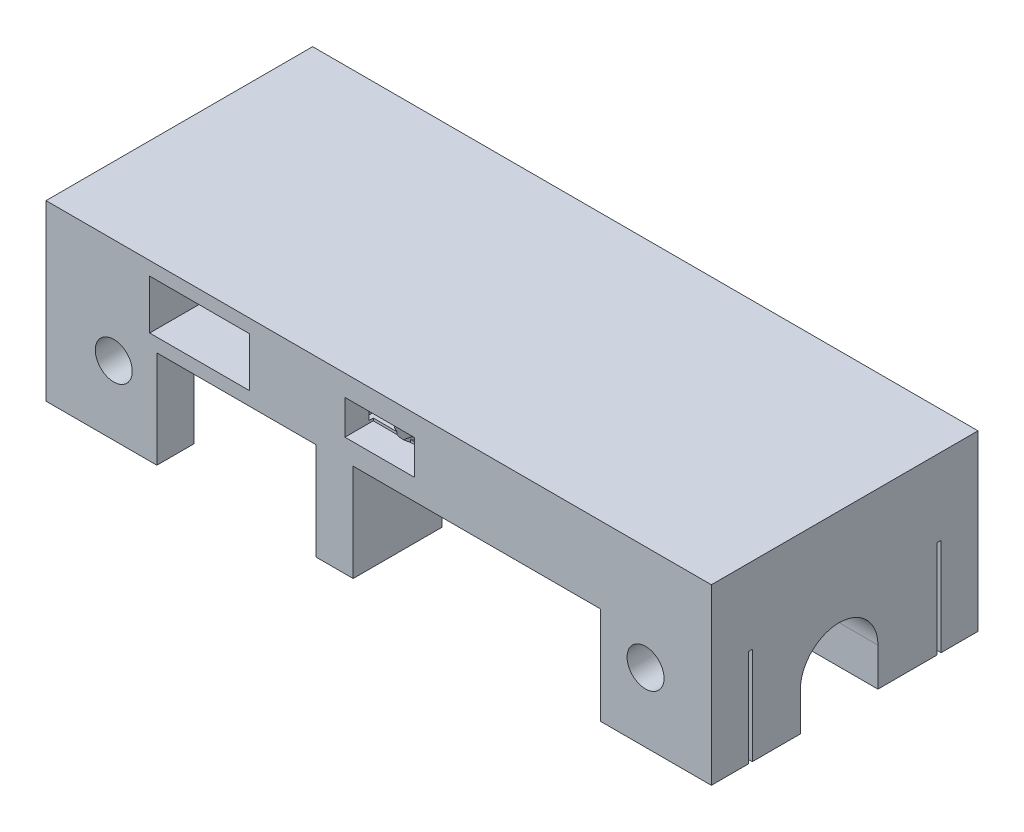
from build123d import *

# Parameters (mm, degrees)
SKETCH2_W           = 54
SKETCH2_H           = 6.2
BOSS_EXTRUDE2_DEPTH = 12.5
SKETCH3_R           = 2.8
CUT_EXTRUDE1_DEPTH  = 6.2
CUT_EXTRUDE2_DEPTH  = 1.9
SKETCH6_W           = 8.1
SKETCH6_H           = 4
CUT_EXTRUDE3_DEPTH  = 8.65741
SKETCH7_W           = 3
SKETCH7_H           = 25
BOSS_EXTRUDE3_DEPTH = 7.9
CUT_EXTRUDE4_DEPTH  = 2
SKETCH9_R           = 0.7
CUT_EXTRUDE5_DEPTH  = 2
SKETCH13_W          = 54
SKETCH13_H          = 2.82
CUT_EXTRUDE6_DEPTH  = 33.925066439
SKETCH18_W          = 3
SKETCH18_H          = 2.82
CUT_EXTRUDE9_DEPTH  = 10
SKETCH19_W          = 0.539072716
SKETCH19_H          = 14.1
CUT_EXTRUDE11_DEPTH = 57.508848865
CUT_EXTRUDE13_DEPTH = 2.5
CUT_EXTRUDE15_START = -2
SKETCH23_R          = 1.6
CUT_EXTRUDE15_DEPTH = 7
CUT_EXTRUDE16_DEPTH = 1.2
SKETCH26_W          = 5.64
SKETCH26_H          = 2.8
CUT_EXTRUDE17_DEPTH = 2.3
SKETCH29_W          = 9
SKETCH29_H          = 3
BOSS_EXTRUDE5_DEPTH = 7.9
SKETCH34_W          = 9
SKETCH34_H          = 7.9
BOSS_EXTRUDE6_DEPTH = 7.5
CUT_EXTRUDE19_DEPTH = 9
CUT_EXTRUDE20_DEPTH = 2.5
SKETCH31_R          = 1.5
CUT_EXTRUDE18_DEPTH = 37.30881069


with BuildPart() as part:
    # Sketch2 → Boss-Extrude2 (new, symmetric)
    with BuildSketch(Plane(origin=(10.528308017, 2.71655886, 0), x_dir=(1, 0, 0), z_dir=(0, 0, 1))):
        with Locations((-10.528308017, -2.71655886)):
            Rectangle(SKETCH2_W, SKETCH2_H)
    extrude(amount=BOSS_EXTRUDE2_DEPTH, both=True)

    # Sketch3 → Cut-Extrude1 (cut)
    with BuildSketch(Plane.XZ.offset(3.1)):
        with Locations((-12.165967216, -142.374755929)):
            Circle(SKETCH3_R)
    extrude(amount=-CUT_EXTRUDE1_DEPTH, mode=Mode.SUBTRACT)

    # Sketch4 → Cut-Extrude2 (cut, symmetric)
    with BuildSketch(Plane(origin=(0, 0, 0), x_dir=(1, 0, 0), z_dir=(0, 1, 0))):
        Polygon((-10.635076842, 0.660738766), (-14.535076842, 2.912404816), (-18.435076842, 0.660738766), (-18.435076842, -3.842593333), (-14.535076842, -6.094259383), (-10.635076842, -3.842593333), align=None)
    extrude(amount=CUT_EXTRUDE2_DEPTH, both=True, mode=Mode.SUBTRACT)

    # Sketch6 → Cut-Extrude3 (cut)
    with BuildSketch(Plane.XY.offset(12.5)):
        with Locations((-14.535076842, 0)):
            Rectangle(SKETCH6_W, SKETCH6_H)
    extrude(amount=-CUT_EXTRUDE3_DEPTH, mode=Mode.SUBTRACT)

    # Sketch7 → Boss-Extrude3 (add)
    with BuildSketch(Plane.XZ.offset(3.1)):
        with Locations((-25.5, 0)):
            Rectangle(SKETCH7_W, SKETCH7_H)
    boss_extrude3 = extrude(amount=BOSS_EXTRUDE3_DEPTH)

    # Sketch8 → Cut-Extrude4 (cut)
    with BuildSketch(Plane.ZY.offset(27)):
        with BuildLine():
            Line((-1.559072716, -7.9), (-1.559072716, -11))
            Line((-1.559072716, -11), (4.740927284, -11))
            Line((4.740927284, -11), (4.740927284, -7.9))
            ThreePointArc((4.740927284, -7.9), (1.590927284, -4.75), (-1.559072716, -7.9))
        make_face()
    cut_extrude4 = extrude(amount=-CUT_EXTRUDE4_DEPTH, mode=Mode.SUBTRACT)

    # Sketch9 → Cut-Extrude5 (cut)
    with BuildSketch(Plane(origin=(-24, 0, 0), x_dir=(0, 0, -1), z_dir=(1, 0, 0))):
        with Locations((142.374755929, -8.1)):
            Circle(SKETCH9_R)
    cut_extrude5 = extrude(amount=-CUT_EXTRUDE5_DEPTH, mode=Mode.SUBTRACT)

    # Sketch13 → Cut-Extrude6 (cut, through all)
    with BuildSketch(Plane(origin=(0, 3.1, 0), x_dir=(1, 0, 0), z_dir=(0, 1, 0))):
        with Locations((0, 11.09)):
            Rectangle(SKETCH13_W, SKETCH13_H)
    extrude(amount=-CUT_EXTRUDE6_DEPTH, mode=Mode.SUBTRACT)

    # Mirror1: Boss-Extrude3, Cut-Extrude4, Cut-Extrude5 across plane
    add(boss_extrude3.mirror(Plane.ZY.offset(14.535076842)))
    add(cut_extrude4.mirror(Plane.ZY.offset(14.535076842)), mode=Mode.SUBTRACT)
    add(cut_extrude5.mirror(Plane.ZY.offset(14.535076842)), mode=Mode.SUBTRACT)

    # Sketch18 → Cut-Extrude9 (cut)
    with BuildSketch(Plane(origin=(0, -3.1, 0), x_dir=(1, 0, 0), z_dir=(0, 1, 0))):
        with Locations((-3.570153685, 11.09)):
            Rectangle(SKETCH18_W, SKETCH18_H)
    extrude(amount=-CUT_EXTRUDE9_DEPTH, mode=Mode.SUBTRACT)

    # Sketch19 → Cut-Extrude11 (cut, through all)
    with BuildSketch(Plane.ZY.offset(27)):
        with Locations((12.230463642, -3.95)):
            Rectangle(SKETCH19_W, SKETCH19_H)
    extrude(amount=-CUT_EXTRUDE11_DEPTH, mode=Mode.SUBTRACT)

    # Sketch22 → Cut-Extrude13 (cut)
    with BuildSketch(Plane.XZ.offset(3.1)):
        Polygon((15, 10.472778345), (12.15, 8.827330078), (12.15, 5.536433544), (15, 3.890985277), (17.85, 5.536433544), (17.85, 8.827330078), align=None)
        Polygon((15, -2.584684642), (12.15, -4.230132909), (12.15, -7.521029443), (15, -9.16647771), (17.85, -7.521029443), (17.85, -4.230132909), align=None)
    extrude(amount=-CUT_EXTRUDE13_DEPTH, mode=Mode.SUBTRACT)

    # Sketch23 → Cut-Extrude15 (cut)
    with BuildSketch(Plane(origin=(0, 3.1, 0), x_dir=(1, 0, 0), z_dir=(0, 1, 0)).offset(CUT_EXTRUDE15_START)):
        with Locations((-0.270153685, 292.910439142)):
            Circle(SKETCH23_R)
        with Locations(Location((-0.270153685, -8.160927284, 0), (0, 0, 180))):
            Circle(SKETCH23_R)
    extrude(amount=-CUT_EXTRUDE15_DEPTH, mode=Mode.SUBTRACT)

    # Sketch24 → Cut-Extrude16 (cut, symmetric)
    with BuildSketch(Plane(origin=(0, 0, 0), x_dir=(1, 0, 0), z_dir=(0, 1, 0))):
        Polygon((-0.270153685, -11.451823818), (2.579846315, -9.806375551), (2.579846315, -6.515479016), (-0.270153685, -4.870030749), (-3.120153685, -6.515479016), (-3.120153685, -9.806375551), align=None)
        Polygon((-0.270153685, 1.688176182), (2.579846315, 3.333624449), (2.579846315, 6.624520984), (-0.270153685, 8.269969251), (-3.120153685, 6.624520984), (-3.120153685, 3.333624449), align=None)
    extrude(amount=CUT_EXTRUDE16_DEPTH, both=True, mode=Mode.SUBTRACT)

    # Sketch26 → Cut-Extrude17 (cut)
    with BuildSketch(Plane.XY.offset(11.960927284)):
        with Locations((0.08, 0)):
            Rectangle(SKETCH26_W, SKETCH26_H)
    cut_extrude17 = extrude(amount=-CUT_EXTRUDE17_DEPTH, mode=Mode.SUBTRACT)

    # Mirror4: Cut-Extrude17 across plane
    add(cut_extrude17.mirror(Plane(origin=(0, 0, 1.140463642), x_dir=(1, 0, 0), z_dir=(0, 0, -1))), mode=Mode.SUBTRACT)

    # Sketch29 → Boss-Extrude5 (add)
    with BuildSketch(Plane.XZ.offset(3.1)):
        with Locations((22.5, 10.460927284)):
            Rectangle(SKETCH29_W, SKETCH29_H)
        with Locations((-22.5, 10.460927284)):
            Rectangle(SKETCH29_W, SKETCH29_H)
    boss_extrude5 = extrude(amount=BOSS_EXTRUDE5_DEPTH)

    # Mirror5: Boss-Extrude5 across plane
    add(boss_extrude5.mirror(Plane(origin=(0, 0, 1.140463642), x_dir=(1, 0, 0), z_dir=(0, 0, -1))))

    # Sketch34 → Boss-Extrude6 (add, symmetric)
    with BuildSketch(Plane(origin=(0, 0, 1.140463642), x_dir=(-1, 0, 0), z_dir=(0, 0, -1))):
        with Locations((-22.5, -7.05)):
            Rectangle(SKETCH34_W, SKETCH34_H)
    extrude(amount=BOSS_EXTRUDE6_DEPTH, both=True)

    # Sketch35 → Cut-Extrude19 (cut)
    with BuildSketch(Plane(origin=(27, 0, 0), x_dir=(0, 0, -1), z_dir=(1, 0, 0))):
        with BuildLine():
            Line((-4.740927284, -11), (1.559072716, -11))
            Line((1.559072716, -11), (1.559072716, -7.9))
            ThreePointArc((1.559072716, -7.9), (-1.590927284, -4.75), (-4.740927284, -7.9))
            Line((-4.740927284, -7.9), (-4.740927284, -11))
        make_face()
    extrude(amount=-CUT_EXTRUDE19_DEPTH, mode=Mode.SUBTRACT)

    # Sketch36 → Cut-Extrude20 (cut)
    with BuildSketch(Plane.XZ.offset(11)):
        with BuildLine():
            Line((-18, -150.496582169), (-18, -147.496582169))
            Line((-18, -147.496582169), (-20.754732899, -147.496582169))
            ThreePointArc((-20.754732899, -147.496582169), (-19.531717613, -149.138314245), (-18, -150.496582169))
        make_face()
        with BuildLine():
            Line((-20.754732899, -137.252929689), (-18, -137.252929689))
            Line((-18, -137.252929689), (-18, -134.252929689))
            ThreePointArc((-18, -134.252929689), (-19.531717613, -135.611197614), (-20.754732899, -137.252929689))
        make_face()
    extrude(amount=-CUT_EXTRUDE20_DEPTH, mode=Mode.SUBTRACT)

    # Sketch31 → Cut-Extrude18 (cut, through all)
    with BuildSketch(Plane(origin=(0, 0, -9.68), x_dir=(-1, 0, 0), z_dir=(0, 0, -1))):
        with Locations(Location((-21.66, -5.4, 0), (0, 0, 90))):
            Circle(SKETCH31_R)
        with Locations((21.5, -5.4)):
            Circle(SKETCH31_R)
    extrude(amount=-CUT_EXTRUDE18_DEPTH, mode=Mode.SUBTRACT)


solid = part.part
